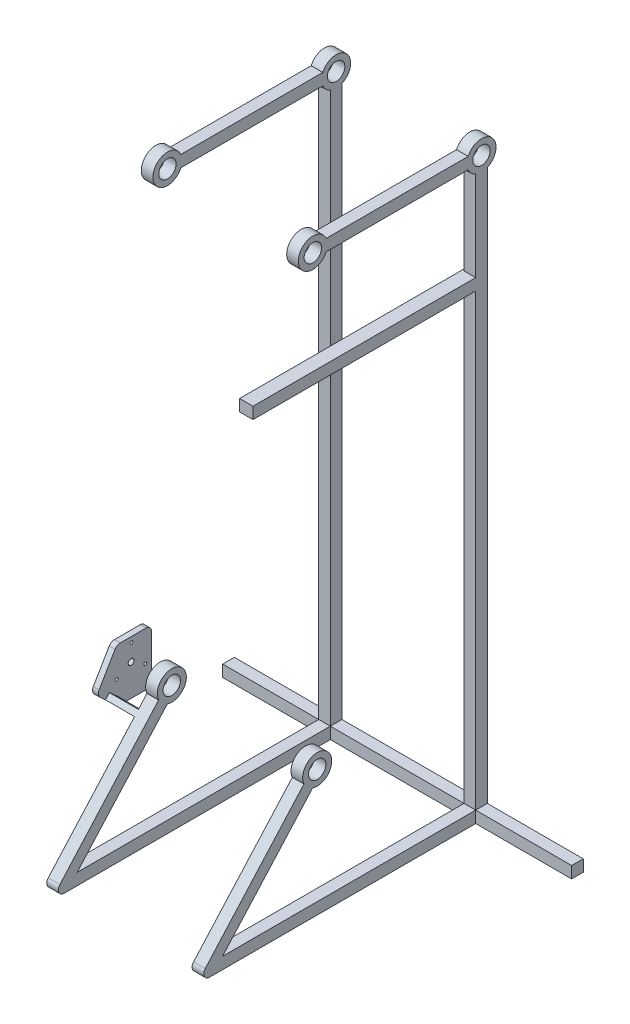
from build123d import *

# Parameters (mm, degrees)
SKETCH1_R                = 15
BOSS_EXTRUDE1_DEPTH      = 20
FILLET1_R                = 10
BOSS_EXTRUDE2_DEPTH      = 300
BOSS_EXTRUDE2_DEPTH_BACK = 300
SKETCH2_W                = 20
SKETCH2_H                = 20
SKETCH3_W                = 403
SKETCH3_H                = 20
BOSS_EXTRUDE3_DEPTH      = 23
BOSS_EXTRUDE4_DEPTH      = 50
SKETCH5_R                = 2.5
SKETCH5_R_2              = 5
BOSS_EXTRUDE5_DEPTH      = 10


with BuildPart() as part:
    # Sketch1 → Boss-Extrude1 (new body)
    with BuildSketch(Plane(origin=(0, 0, 0), x_dir=(0, 0, -1), z_dir=(1, 0, 0))):
        with BuildLine():
            Line((-277.087121525, 516.456439237), (-32.912878475, 516.456439237))
            ThreePointArc((-32.912878475, 516.456439237), (7.67766953, 524.134108767), (0, 483.543560763))
            Line((0, 483.543560763), (0, -483.543560763))
            Line((0, -483.543560763), (-500, -483.543560763))
            Line((-500, -483.543560763), (-315.275252317, -277.015014289))
            ThreePointArc((-315.275252317, -277.015014289), (-275.879773408, -247.969529867), (-300.368132467, -290.348347623))
            Line((-300.368132467, -290.348347623), (-455.27864045, -463.543560763))
            Line((-455.27864045, -463.543560763), (-20, -463.543560763))
            Line((-20, -463.543560763), (-20, 483.543560763))
            ThreePointArc((-20, 483.543560763), (-27.67766953, 488.778769708), (-32.912878475, 496.456439237))
            Line((-32.912878475, 496.456439237), (-277.087121525, 496.456439237))
            ThreePointArc((-277.087121525, 496.456439237), (-325, 506.456439237), (-277.087121525, 516.456439237))
        make_face()
        with Locations((-292.546440075, -266.603429679)):
            Circle(SKETCH1_R, mode=Mode.SUBTRACT)
        with Locations((-300, 506.456439237)):
            Circle(SKETCH1_R, mode=Mode.SUBTRACT)
        with Locations((-10, 506.456439237)):
            Circle(SKETCH1_R, mode=Mode.SUBTRACT)
    extrude(amount=BOSS_EXTRUDE1_DEPTH)

    # Fillet1
    fillet1_edges = [part.edges().sort_by_distance(p)[0] for p in [
        (10, -483.543560763, 500),
    ]]
    fillet(fillet1_edges, radius=FILLET1_R)


with BuildPart() as body_2:
    # Mirror2: mirrored copy
    add(part.part.mirror(Plane(origin=(-115, 0, 0), x_dir=(0, 0, 1), z_dir=(1, 0, 0))))


with BuildPart() as part_1:
    add(part.part)

    add(body_2.part)  # Boss-Extrude2 merges body 2
    # Sketch2 → Boss-Extrude2 (add, two sides: drawn at the far end of the back side and taken through both)
    with BuildSketch(Plane(origin=(-115, 0, 0), x_dir=(0, 0, -1), z_dir=(1, 0, 0)).offset(-BOSS_EXTRUDE2_DEPTH_BACK)):
        with Locations((-10, -473.543560763)):
            Rectangle(SKETCH2_W, SKETCH2_H)
    extrude(amount=BOSS_EXTRUDE2_DEPTH + BOSS_EXTRUDE2_DEPTH_BACK)

    # Sketch3 → Boss-Extrude3 (add)
    with BuildSketch(Plane(origin=(20, 0, 0), x_dir=(0, 0, -1), z_dir=(1, 0, 0))):
        with Locations((-201.5, 319.456439237)):
            Rectangle(SKETCH3_W, SKETCH3_H)
    extrude(amount=-BOSS_EXTRUDE3_DEPTH)

    # Sketch4 → Boss-Extrude4 (add)
    with BuildSketch(Plane.ZY.offset(250)):
        Polygon((330, -293.477782675), (315.09288015, -306.811116008), (321.759546817, -314.264675933), (336.666666667, -300.9313426), align=None)
    extrude(amount=BOSS_EXTRUDE4_DEPTH)

    # Sketch5 → Boss-Extrude5 (add)
    with BuildSketch(Plane.ZY.offset(300)):
        with BuildLine():
            Line((317.152993446, -318.384902525), (345.480143996, -293.048328829))
            ThreePointArc((345.480143996, -293.048328829), (348.692480121, -287.145673106), (347.443414331, -280.542622098))
            Line((347.443414331, -280.542622098), (320.125662167, -233.879195794))
            ThreePointArc((320.125662167, -233.879195794), (316.469583424, -230.256048136), (311.495725166, -228.9313426))
            Line((311.495725166, -228.9313426), (267.229084741, -228.9313426))
            ThreePointArc((267.229084741, -228.9313426), (260.158016929, -231.860274788), (257.229084741, -238.9313426))
            Line((257.229084741, -238.9313426), (257.229084741, -310.9313426))
            ThreePointArc((257.229084741, -310.9313426), (260.158016929, -318.002410412), (267.229084741, -320.9313426))
            Line((267.229084741, -320.9313426), (310.486326779, -320.9313426))
            ThreePointArc((310.486326779, -320.9313426), (314.054547677, -320.27306619), (317.152993446, -318.384902525))
        make_face()
        with Locations((317.547753068, -280.286250567)):
            Circle(SKETCH5_R, mode=Mode.SUBTRACT)
        with Locations((268.196113094, -281.413791415)):
            Circle(SKETCH5_R, mode=Mode.SUBTRACT)
        with Locations((291.895454063, -238.110247055)):
            Circle(SKETCH5_R, mode=Mode.SUBTRACT)
        with Locations((292.546440075, -266.603429679)):
            Circle(SKETCH5_R_2, mode=Mode.SUBTRACT)
    extrude(amount=BOSS_EXTRUDE5_DEPTH)


solid = part_1.part
